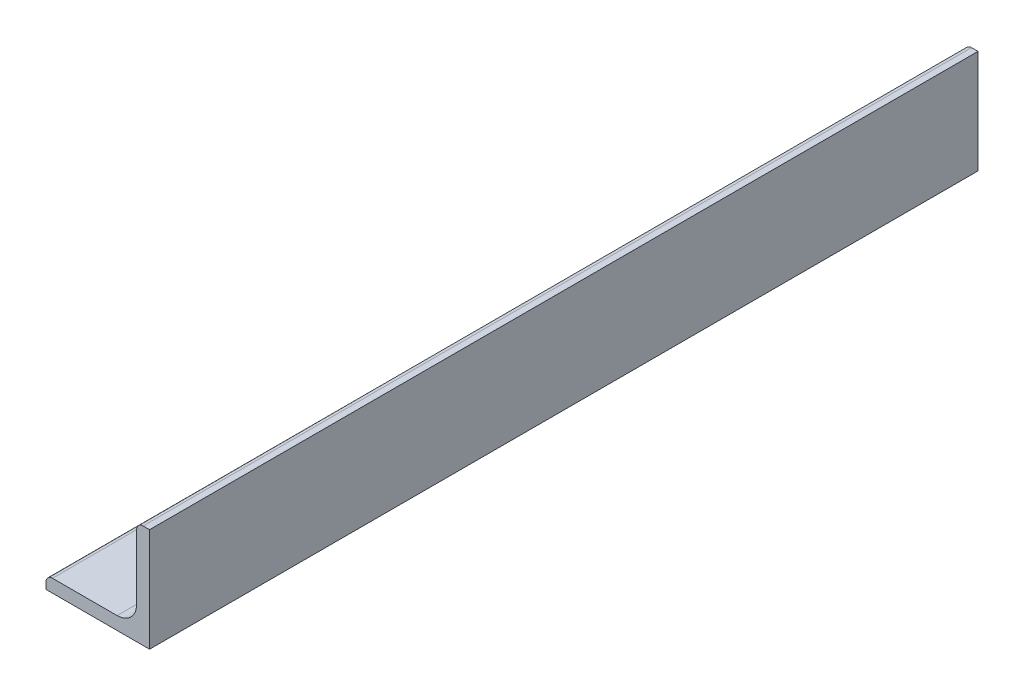
from build123d import *

# Parameters (mm, degrees)
BOSS_EXTRUDE1_DEPTH = 101.6


with BuildPart() as part:
    # Sketch2 → Boss-Extrude1 (new, symmetric)
    with BuildSketch(Plane.XY):
        with BuildLine():
            Line((-12.7, -12.7), (12.7, -12.7))
            Line((12.7, -12.7), (12.7, 12.7))
            Line((12.7, 12.7), (11.1125, 12.7))
            ThreePointArc((11.1125, 12.7), (9.989967985, 12.235032015), (9.525, 11.1125))
            Line((9.525, 11.1125), (9.525, -4.7498))
            ThreePointArc((9.525, -4.7498), (8.126376302, -8.126376302), (4.7498, -9.525))
            Line((4.7498, -9.525), (-11.1125, -9.525))
            ThreePointArc((-11.1125, -9.525), (-12.235032015, -9.989967985), (-12.7, -11.1125))
            Line((-12.7, -11.1125), (-12.7, -12.7))
        make_face()
    extrude(amount=BOSS_EXTRUDE1_DEPTH, both=True)


solid = part.part
